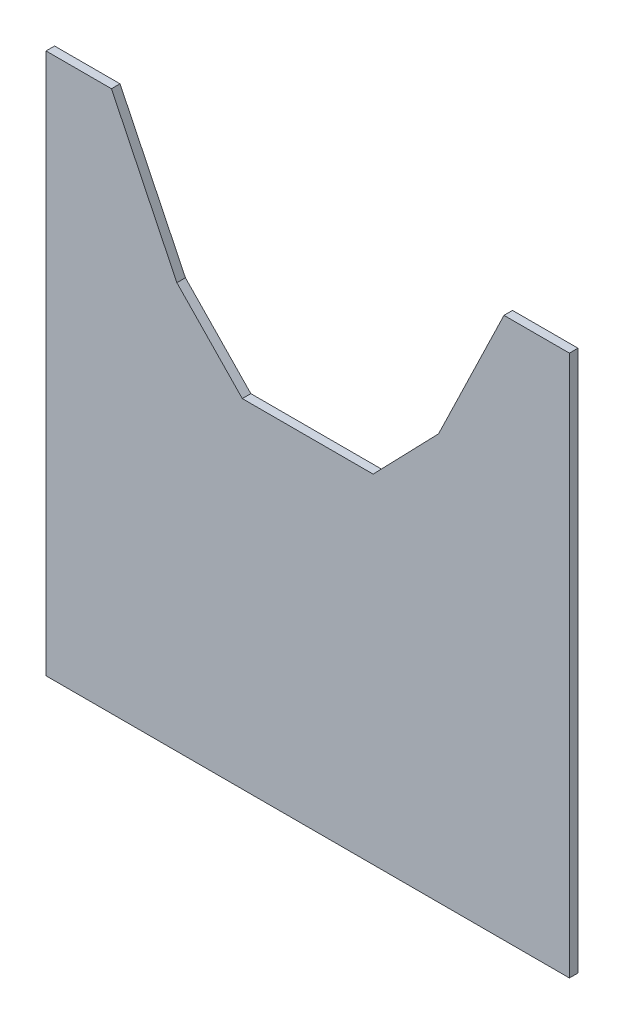
from build123d import *

# Parameters (mm, degrees)
BOSS_EXTRUDE1_DEPTH = 3.175


with BuildPart() as part:
    # Sketch1 → Boss-Extrude1 (new body)
    with BuildSketch(Plane.XY):
        Polygon((-97.155, 100.457), (-72.86625, 100.457), (-48.5775, 50.2285), (-24.28875, 25.11425), (24.28875, 25.11425), (48.5775, 50.2285), (72.86625, 100.457), (97.155, 100.457), (97.155, -100.457), (-97.155, -100.457), align=None)
    extrude(amount=BOSS_EXTRUDE1_DEPTH)


solid = part.part
